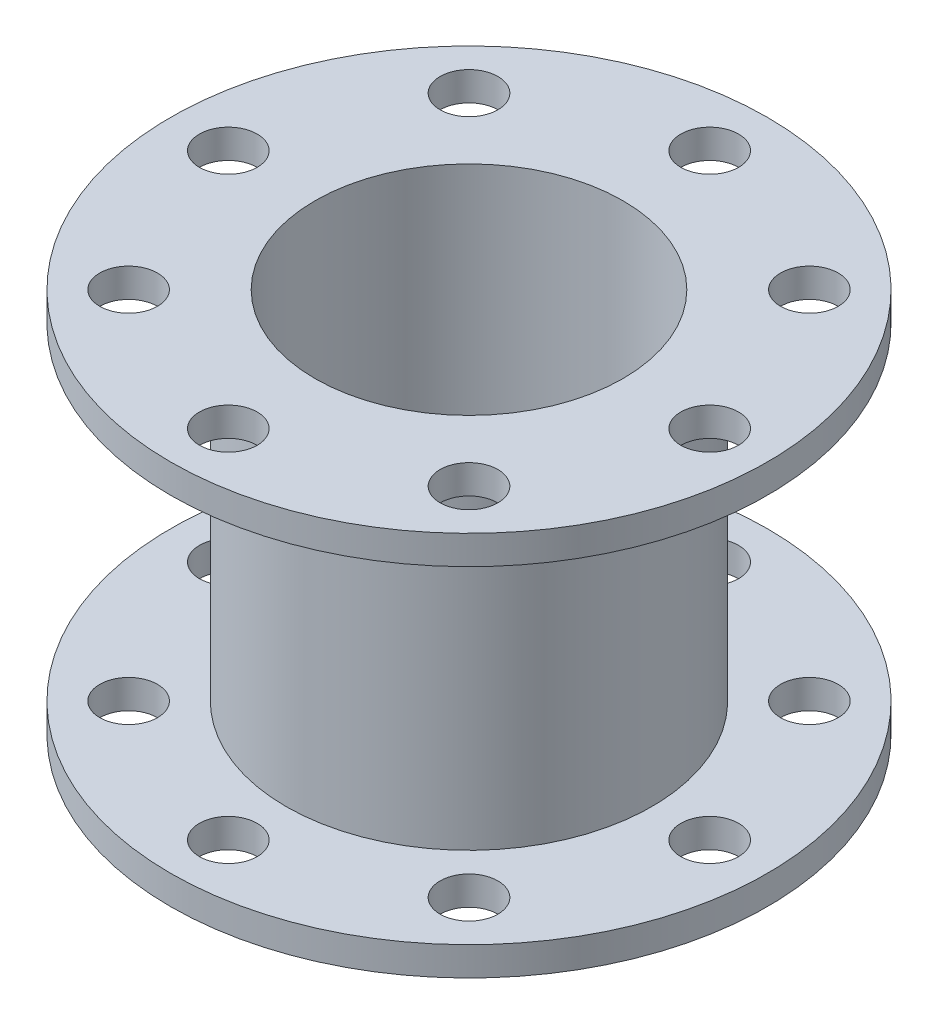
from build123d import *

# Parameters (mm, degrees)
SKETCH5_R          = 3
CUT_EXTRUDE2_DEPTH = 500
CIRPATTERN2_COUNT  = 8


with BuildPart() as part:
    # Sketch4 → Revolve1 (revolve)
    with BuildSketch(Plane.XY, mode=Mode.PRIVATE) as revolve1_sk:
        Polygon((19, 17), (19, -17), (31, -17), (31, -20), (16, -20), (16, 20), (31, 20), (31, 17), align=None)
    revolve(revolve1_sk.sketch.rotate(Axis((0, 0, 0), (0, 1, 0)), 90), axis=Axis((0, 0, 0), (0, 1, 0)))

    # Sketch5 → Cut-Extrude2 (cut, symmetric)
    with BuildSketch(Plane(origin=(0, -17, 0), x_dir=(1, 0, 0), z_dir=(0, 1, 0))):
        with Locations(Location((25, 0, 0), (0, 0, 90))):
            Circle(SKETCH5_R)
    cut_extrude2 = extrude(amount=CUT_EXTRUDE2_DEPTH, both=True, mode=Mode.SUBTRACT)

    # CirPattern2: Cut-Extrude2 ×8 about axis
    cirpattern2_axis = Axis((0, 0, 0), (0, 1, 0))
    for i in range(1, CIRPATTERN2_COUNT):
        add(cut_extrude2.rotate(cirpattern2_axis, i * 360 / CIRPATTERN2_COUNT), mode=Mode.SUBTRACT)


solid = part.part
